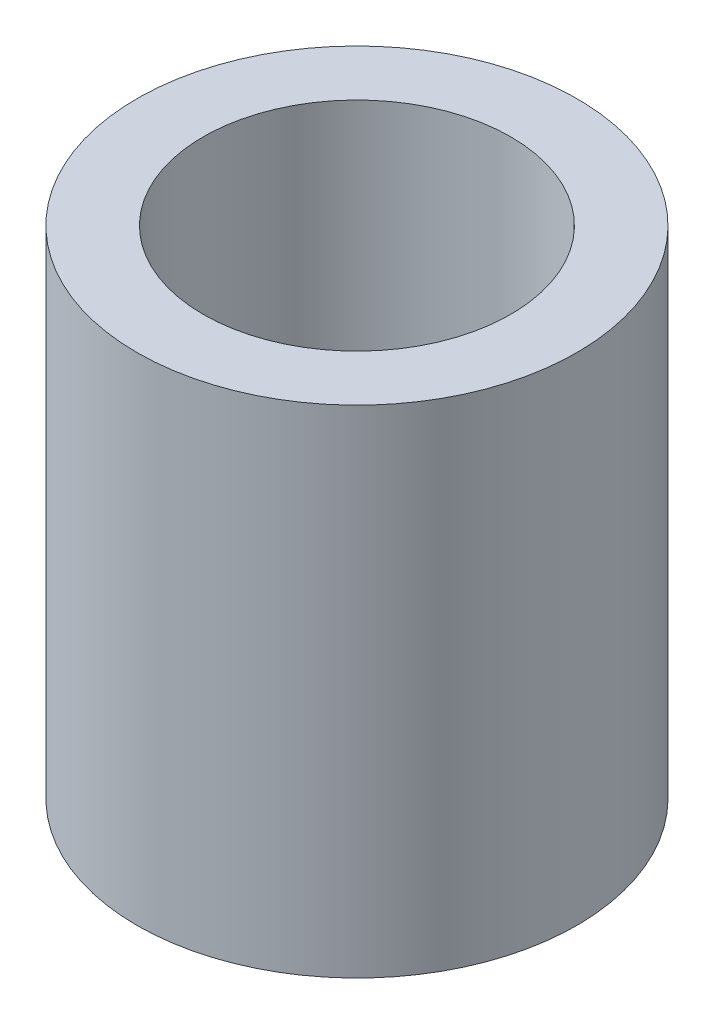
from build123d import *

# Parameters (mm, degrees)
SKETCH1_R           = 6.65
SKETCH1_R_2         = 4.65
BOSS_EXTRUDE1_DEPTH = 15


with BuildPart() as part:
    # Sketch1 → Boss-Extrude1 (new body)
    with BuildSketch(Plane(origin=(0, 0, 0), x_dir=(1, 0, 0), z_dir=(0, 1, 0))):
        with Locations(Location((0, 0, 0), (0, 0, 270))):
            Circle(SKETCH1_R)
        with Locations(Location((0, 0, 0), (0, 0, 270))):
            Circle(SKETCH1_R_2, mode=Mode.SUBTRACT)
    extrude(amount=BOSS_EXTRUDE1_DEPTH)


solid = part.part
